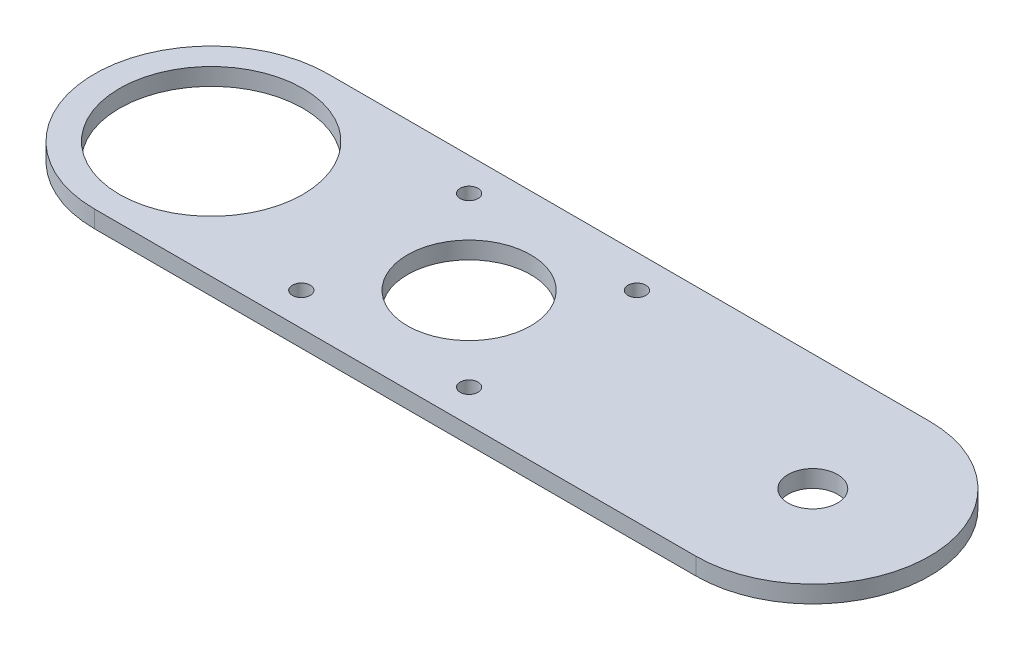
from build123d import *

# Parameters (mm, degrees)
SKETCH1_R           = 16.9545
SKETCH1_R_2         = 4.572
SKETCH1_R_3         = 11.380999971
SKETCH1_R_4         = 1.651
BOSS_EXTRUDE1_DEPTH = 3.175


with BuildPart() as part:
    # Sketch1 → Boss-Extrude1 (new body)
    with BuildSketch(Plane(origin=(0, 0, 0), x_dir=(1, 0, 0), z_dir=(0, 1, 0))):
        with BuildLine():
            Line((0, 21.59), (111.1504, 21.59))
            ThreePointArc((111.1504, 21.59), (132.7404, 0), (111.1504, -21.59))
            Line((111.1504, -21.59), (0, -21.59))
            ThreePointArc((0, -21.59), (-21.59, 0), (0, 21.59))
        make_face()
        with Locations(Location((0, 0, 0), (0, 0, 270))):
            Circle(SKETCH1_R, mode=Mode.SUBTRACT)
        with Locations(Location((111.1504, 0, 0), (0, 0, 270))):
            Circle(SKETCH1_R_2, mode=Mode.SUBTRACT)
        with Locations(Location((47.6504, 0, 0), (0, 0, 270))):
            Circle(SKETCH1_R_3, mode=Mode.SUBTRACT)
        with Locations(Location((32.1504, -15.5, 0), (0, 0, 270))):
            Circle(SKETCH1_R_4, mode=Mode.SUBTRACT)
        with Locations(Location((32.1504, 15.5, 0), (0, 0, 270))):
            Circle(SKETCH1_R_4, mode=Mode.SUBTRACT)
        with Locations(Location((63.1504, 15.5, 0), (0, 0, 90))):
            Circle(SKETCH1_R_4, mode=Mode.SUBTRACT)
        with Locations(Location((63.1504, -15.5, 0), (0, 0, 90))):
            Circle(SKETCH1_R_4, mode=Mode.SUBTRACT)
    extrude(amount=BOSS_EXTRUDE1_DEPTH)


solid = part.part
